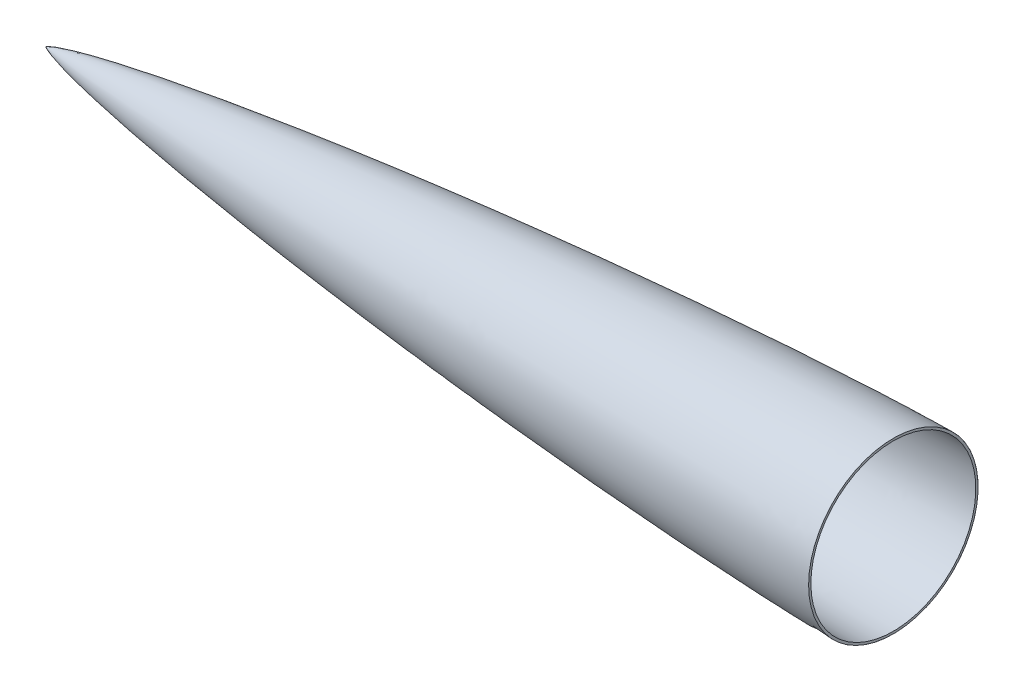
from build123d import *


with BuildPart() as part:
    # Sketch2 → Revolve1 (revolve)
    with BuildSketch(Plane.XY, mode=Mode.PRIVATE) as revolve1_sk:
        with BuildLine():
            Line((0, 0), (4.552555597, 0))
            add(Edge.make_bspline(
                [(4.552555597, 0), (5.445018222, 0.324851789), (7.238985949, 0.923010218), (10.928879317, 2.035076929), (17.470823328, 3.796049572), (26.944450926, 6.017468658), (38.38710912, 8.424081686), (53.706714586, 11.398322285), (72.931846424, 14.792456575), (96.067919313, 18.526465576), (119.249807278, 22.00672428), (150.202374057, 26.376394952), (188.95728034, 31.415002087), (235.531471027, 36.945375998), (282.157954731, 42.042348478), (328.825989737, 46.759546557), (391.096739156, 52.583813797), (469.010319037, 59.042664613), (547.004359649, 64.433928433), (609.441331189, 68.031853787), (656.287575483, 70.324980762), (695.342084637, 71.829704962), (722.680234864, 72.586297012), (738.305795074, 72.888338901), (746.103809692, 72.990306515), (750.00497269, 73.000006182)],
                knots=[0.005736518, 0.005736518, 0.005736518, 0.005736518, 0.00962036, 0.013504202, 0.021271885, 0.036807252, 0.052342619, 0.067877986, 0.09894872, 0.130019453, 0.161090187, 0.192160921, 0.254302389, 0.316443856, 0.378585324, 0.440726791, 0.502868259, 0.627151194, 0.75143413, 0.813575597, 0.875717065, 0.937858532, 0.968929266, 0.984464633, 1, 1, 1, 1], degree=3))
            Line((750.00497269, 73.000006182), (750, 75))
            add(Edge.make_bspline(
                [(0, 0), (0.002661369, 0.00735768), (0.009108664, 0.021455176), (0.026858739, 0.047022825), (0.06841925, 0.093346235), (0.131428409, 0.1510252), (0.216810716, 0.21833703), (0.338162364, 0.304110587), (0.48394243, 0.397396692), (0.655054985, 0.498068807), (0.851568565, 0.605626998), (1.137654509, 0.753350528), (1.581543682, 0.966113556), (2.335050733, 1.296122672), (3.682901567, 1.826629283), (6.111473252, 2.674476309), (10.574628301, 4.037968264), (18.951733743, 6.252001296), (33.570100518, 9.565304084), (58.406653249, 14.407879587), (92.507874052, 20.12088369), (133.842049801, 26.225056743), (179.809214733, 32.306451647), (225.84209313, 37.86321125), (271.925422623, 42.983912816), (318.04912254, 47.72529812), (364.207064366, 52.120679156), (410.394737335, 56.191009866), (456.609131982, 59.945893406), (502.84798368, 63.386478656), (549.109760477, 66.50424795), (595.393392595, 69.279792224), (635.910176338, 71.377324916), (670.6520208, 72.898528506), (698.66827638, 73.906563077), (717.52848444, 74.458019085), (733.022602025, 74.804058757), (742.723636447, 74.948033977), (747.57448889, 74.993969324), (750, 75)],
                knots=[0, 0, 0, 0, 0, 4.1103e-05, 8.2207e-05, 0.000164413, 0.000328826, 0.000493239, 0.000657652, 0.000951494, 0.001245335, 0.001544792, 0.001844249, 0.002657057, 0.00385252, 0.005901677, 0.009515863, 0.016280764, 0.028569004, 0.051793804, 0.088907366, 0.150314205, 0.211721038, 0.273127872, 0.334534706, 0.395941541, 0.457348376, 0.518755211, 0.580162046, 0.641568881, 0.702975716, 0.764382551, 0.825789386, 0.887196222, 0.917899639, 0.948603057, 0.974301528, 0.987150764, 1, 1, 1, 1, 1], degree=4))
        make_face()
        Polygon((750, 75), (750.00497269, 75), (750.00497269, 73.000006182), align=None)
    revolve(revolve1_sk.sketch.rotate(Axis((0, 0, 0), (1, 0, 0)), 90), axis=Axis((0, 0, 0), (1, 0, 0)))


solid = part.part
